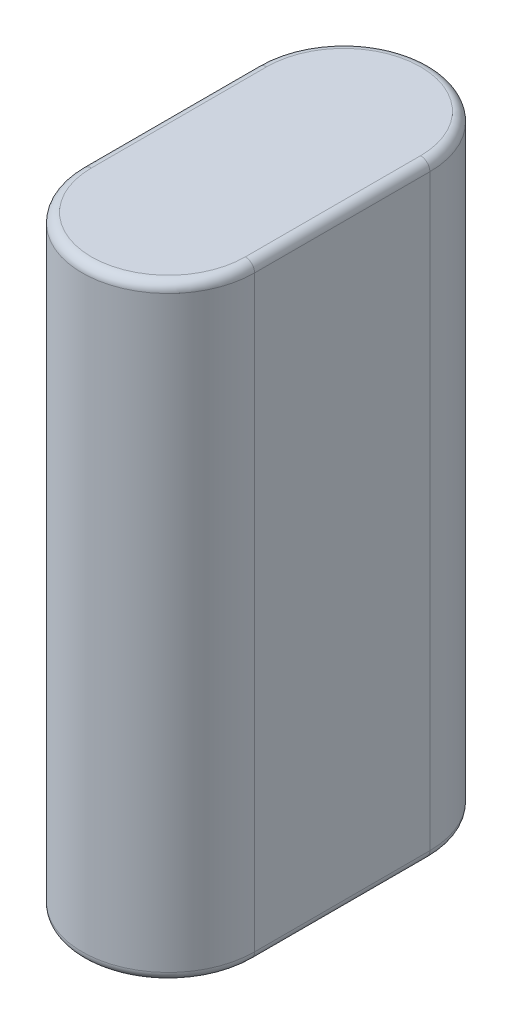
from build123d import *

# Parameters (mm, degrees)
EXTRUDE_1_DEPTH = 65.4
FILLET_1_R      = 1


with BuildPart() as part:
    # 草图1 → 凸台-拉伸1 (new body)
    with BuildSketch(Plane(origin=(0, 0, 0), x_dir=(1, 0, 0), z_dir=(0, 1, 0))):
        with BuildLine():
            Line((9.3, 9.45), (9.3, -9.45))
            ThreePointArc((9.3, -9.45), (0, -18.75), (-9.3, -9.45))
            Line((-9.3, -9.45), (-9.3, 9.45))
            ThreePointArc((-9.3, 9.45), (0, 18.75), (9.3, 9.45))
        make_face()
    extrude(amount=EXTRUDE_1_DEPTH)

    # 圆角1
    fillet_1_edges = [part.edges().sort_by_distance(p)[0] for p in [
        (0, 65.4, 18.75),
        (9.3, 65.4, 0),
        (0, 65.4, -18.75),
        (9.3, 0, 0),
        (0, 0, 18.75),
        (-9.3, 0, 0),
        (0, 0, -18.75),
        (-9.3, 65.4, 0),
    ]]
    fillet(fillet_1_edges, radius=FILLET_1_R)


solid = part.part
